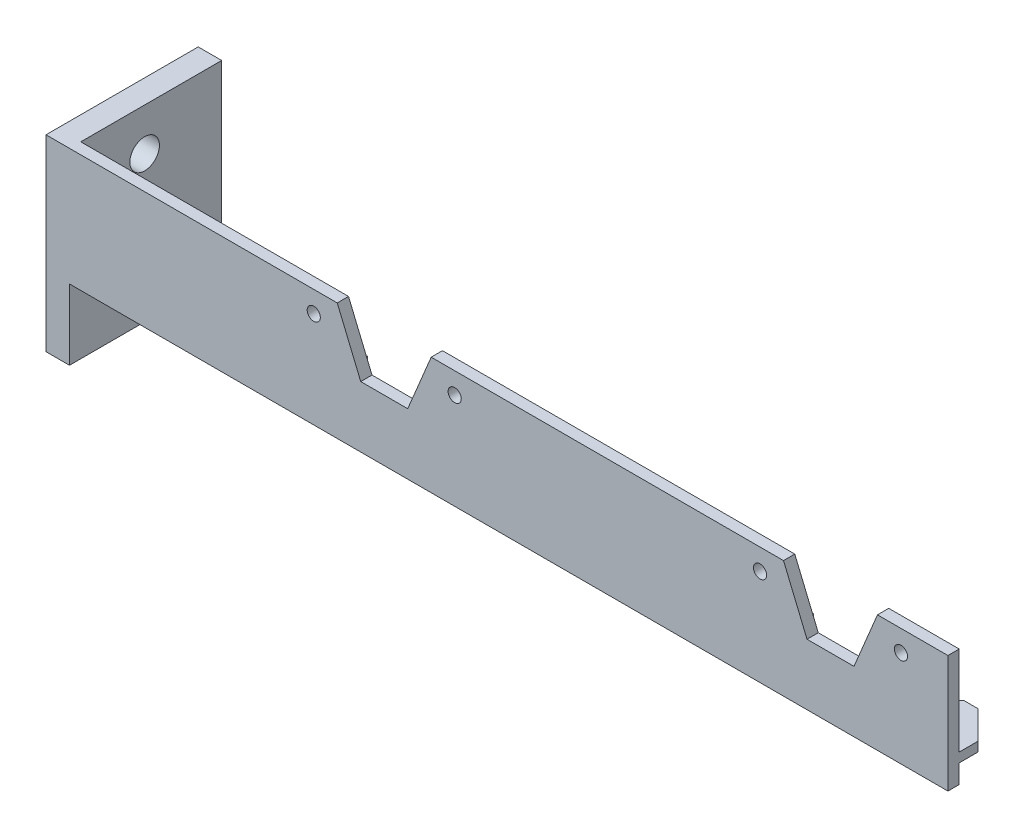
from build123d import *

# Parameters (mm, degrees)
SKETCH1_W                       = 192
SKETCH1_H                       = 25
BOSS_EXTRUDE1_DEPTH             = 2.4
SKETCH2_R                       = 1.4
CUT_EXTRUDE1_DEPTH              = 194.635637216
SKETCH3_W                       = 5
SKETCH3_H                       = 40
BOSS_EXTRUDE2_DEPTH             = 30
BOSS_EXTRUDE2_DIRECTION_2_REACH = 195.636
SKETCH4_R                       = 3.15
CUT_EXTRUDE2_DEPTH              = 30
SKETCH8_W                       = 10
SKETCH8_H                       = 2
BOSS_EXTRUDE4_DEPTH             = 187
SKETCH9_W                       = 20
SKETCH9_H                       = 13.857334598
CUT_EXTRUDE4_DEPTH              = 199.403628999
CHAMFER5_SIZE                   = 6


with BuildPart() as part:
    # Sketch1 → Boss-Extrude1 (new body)
    with BuildSketch(Plane.XY):
        with Locations((96, 12.5)):
            Rectangle(SKETCH1_W, SKETCH1_H)
    extrude(amount=BOSS_EXTRUDE1_DEPTH)

    # Sketch2 → Cut-Extrude1 (cut, through all)
    with BuildSketch(Plane.XY.offset(2.4)):
        with Locations((87, 20.5)):
            Circle(SKETCH2_R)
        with Locations(Location((57, 20.5, 0), (0, 0, 180))):
            Circle(SKETCH2_R)
        with Locations(Location((152, 20.5, 0), (0, 0, 180))):
            Circle(SKETCH2_R)
        with Locations((182, 20.5)):
            Circle(SKETCH2_R)
        Polygon((177, 25), (172, 13), (162, 13), (157, 25), align=None)
        Polygon((82, 25), (77, 13), (67, 13), (62, 25), align=None)
    extrude(amount=-CUT_EXTRUDE1_DEPTH, mode=Mode.SUBTRACT)

    # Sketch3 → Boss-Extrude2 (add)
    with BuildSketch(Plane(origin=(0, 0, 0), x_dir=(-1, 0, 0), z_dir=(0, 0, -1))):
        with Locations((-2.5, 5)):
            Rectangle(SKETCH3_W, SKETCH3_H)
    extrude(amount=BOSS_EXTRUDE2_DEPTH)

    # Boss-Extrude2 direction 2: up to this face of the body (flat: up to its plane)
    boss_extrude2_direction_2_end = Plane(part.part.faces().sort_by_distance((93.952876609, 11.871051408, 2.4))[0])
    # Sketch3 → Boss-Extrude2 direction 2 (add, up to the picked face)
    with BuildSketch(Plane(origin=(0, 0, 0), x_dir=(-1, 0, 0), z_dir=(0, 0, -1)), mode=Mode.PRIVATE) as boss_extrude2_direction_2_sk1:
        with Locations((-2.5, 5)):
            Rectangle(SKETCH3_W, SKETCH3_H)
    boss_extrude2_direction_2_tool1 = split(extrude(boss_extrude2_direction_2_sk1.sketch, amount=-BOSS_EXTRUDE2_DIRECTION_2_REACH, mode=Mode.PRIVATE), bisect_by=boss_extrude2_direction_2_end, keep=Keep.BOTH, mode=Mode.PRIVATE)
    add(boss_extrude2_direction_2_tool1.solids().sort_by(Axis((2.5, 5, 0), (0, 0, 1)))[0])

    # Sketch4 → Cut-Extrude2 (cut)
    with BuildSketch(Plane.ZY):
        with Locations((-13.6, 16)):
            Circle(SKETCH4_R)
        with Locations((-13.6, -6)):
            Circle(SKETCH4_R)
    extrude(amount=-CUT_EXTRUDE2_DEPTH, mode=Mode.SUBTRACT)

    # Sketch8 → Boss-Extrude4 (add)
    with BuildSketch(Plane(origin=(5, 0, 0), x_dir=(0, 0, -1), z_dir=(1, 0, 0))):
        with Locations((5, 5)):
            Rectangle(SKETCH8_W, SKETCH8_H)
    extrude(amount=BOSS_EXTRUDE4_DEPTH)

    # Sketch9 → Cut-Extrude4 (cut, through all)
    with BuildSketch(Plane(origin=(0, 25, 0), x_dir=(1, 0, 0), z_dir=(0, 1, 0))):
        with Locations((72, 6.928667299)):
            Rectangle(SKETCH9_W, SKETCH9_H)
        with Locations((167, 6.928667299)):
            Rectangle(SKETCH9_W, SKETCH9_H)
    extrude(amount=-CUT_EXTRUDE4_DEPTH, mode=Mode.SUBTRACT)

    # Chamfer5
    chamfer5_edges = [part.edges().sort_by_distance(p)[0] for p in [
        (62, 5, -10),
        (82, 5, -10),
        (157, 5, -10),
        (177, 5, -10),
        (192, 5, -10),
    ]]
    chamfer(chamfer5_edges, length=CHAMFER5_SIZE)


solid = part.part
